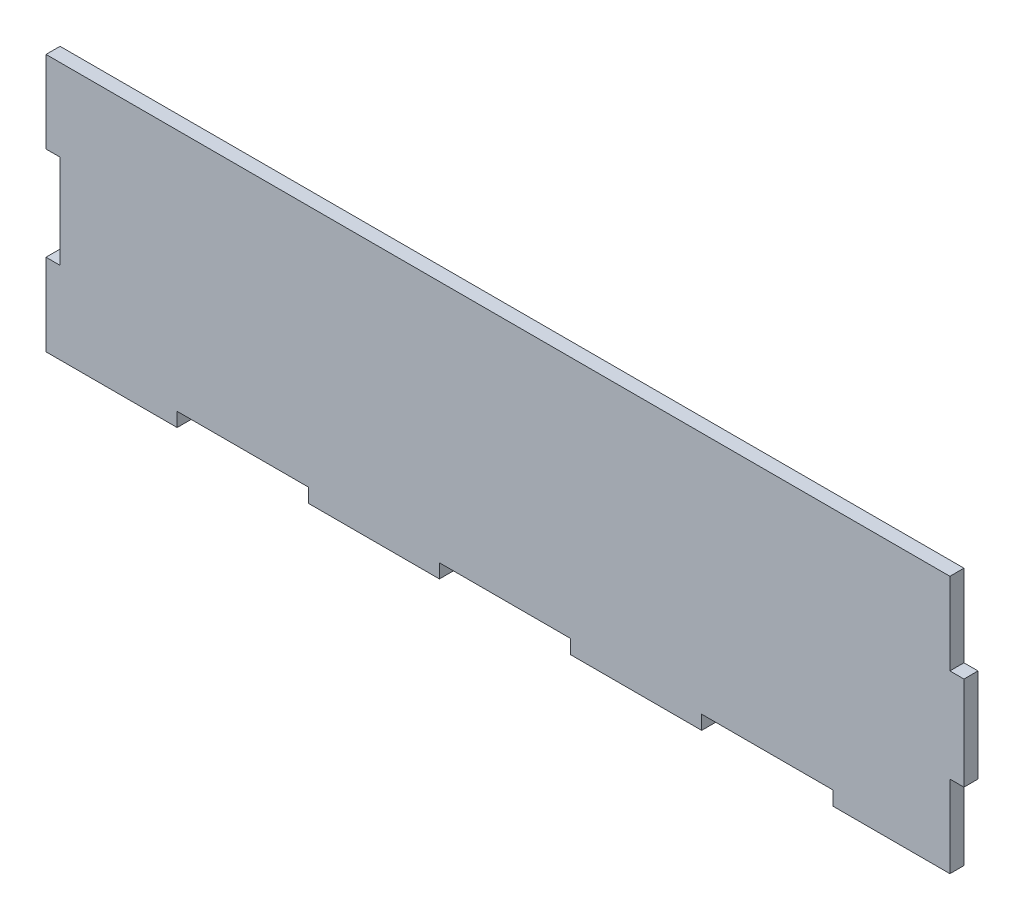
from build123d import *

# Parameters (mm, degrees)
BOSS_EXTRUDE1_DEPTH = 3


with BuildPart() as part:
    # Sketch1 → Boss-Extrude1 (new body)
    with BuildSketch(Plane.XY):
        Polygon((-95, -10), (-98, -10), (-98, -27.5), (-70, -27.5), (-70, -24.5), (-42, -24.5), (-42, -27.5), (-14, -27.5), (-14, -24.5), (14, -24.5), (14, -27.5), (42, -27.5), (42, -24.5), (70, -24.5), (70, -27.5), (95, -27.5), (95, -10), (98, -10), (98, 10), (95, 10), (95, 27.5), (-98, 27.5), (-98, 10), (-95, 10), align=None)
    extrude(amount=BOSS_EXTRUDE1_DEPTH)


solid = part.part
